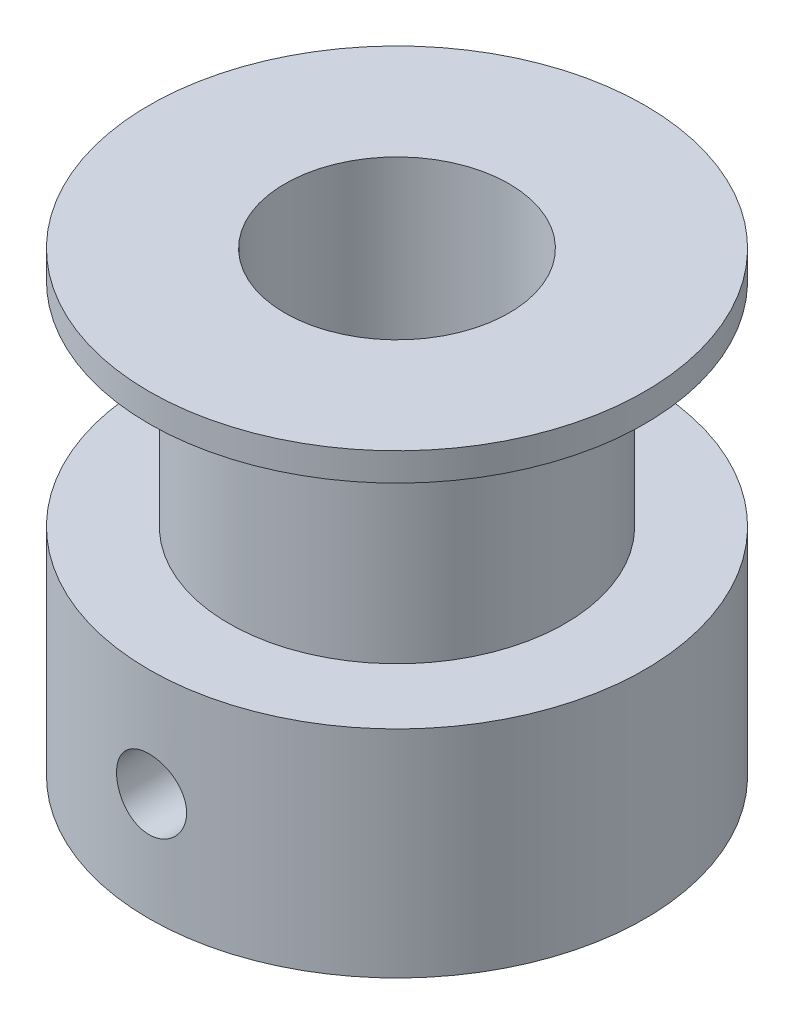
from build123d import *

# Parameters (mm, degrees)
CROQUIS1_R              = 8.85
SALIENTE_EXTRUIR1_DEPTH = 7.7
CROQUIS2_R              = 6
SALIENTE_EXTRUIR2_DEPTH = 7.6
CROQUIS3_R              = 8.85
SALIENTE_EXTRUIR3_DEPTH = 1
CROQUIS4_R              = 4
CORTAR_EXTRUIR1_DEPTH   = 21.550790739
CROQUIS5_W              = 1.25
CROQUIS5_H              = 8.851
MATRIZC1_COUNT          = 2
MATRIZC1_ANGLE          = 90


with BuildPart() as part:
    # Croquis1 → Saliente-Extruir1 (new body)
    with BuildSketch(Plane(origin=(0, 0, 0), x_dir=(1, 0, 0), z_dir=(0, 1, 0))):
        with Locations(Location((0, 0, 0), (0, 0, 90))):
            Circle(CROQUIS1_R)
    extrude(amount=SALIENTE_EXTRUIR1_DEPTH)

    # Croquis2 → Saliente-Extruir2 (add)
    with BuildSketch(Plane(origin=(0, 7.7, 0), x_dir=(1, 0, 0), z_dir=(0, 1, 0))):
        with Locations(Location((0, 0, 0), (0, 0, 90))):
            Circle(CROQUIS2_R)
    extrude(amount=SALIENTE_EXTRUIR2_DEPTH)

    # Croquis3 → Saliente-Extruir3 (add)
    with BuildSketch(Plane(origin=(0, 15.3, 0), x_dir=(1, 0, 0), z_dir=(0, 1, 0))):
        with Locations(Location((0, 0, 0), (0, 0, 90))):
            Circle(CROQUIS3_R)
    extrude(amount=SALIENTE_EXTRUIR3_DEPTH)

    # Croquis4 → Cortar-Extruir1 (cut, through all)
    with BuildSketch(Plane(origin=(0, 16.3, 0), x_dir=(1, 0, 0), z_dir=(0, 1, 0))):
        with Locations(Location((0, 0, 0), (0, 0, 270))):
            Circle(CROQUIS4_R)
    extrude(amount=-CORTAR_EXTRUIR1_DEPTH, mode=Mode.SUBTRACT)

    # Croquis5 → Taladro roscado M31 (definir posicio) (revolve, cut)
    with BuildSketch(Plane(origin=(0, 3.85, 0), x_dir=(0, 1, 0), z_dir=(1, 0, 0))):
        with Locations((0.625, 4.4255)):
            Rectangle(CROQUIS5_W, CROQUIS5_H)
    taladro_roscado_m31_definir_posicio = revolve(axis=Axis((0, 3.85, -6.35), (0, 0, 1)), mode=Mode.SUBTRACT)

    # MatrizC1: Taladro roscado M31 (definir posicio) ×2 about axis
    matrizc1_axis = Axis((0, 7.7, 0), (0, -1, 0))
    for i in range(1, MATRIZC1_COUNT):
        add(taladro_roscado_m31_definir_posicio.rotate(matrizc1_axis, i * MATRIZC1_ANGLE / (MATRIZC1_COUNT - 1)), mode=Mode.SUBTRACT)


solid = part.part
